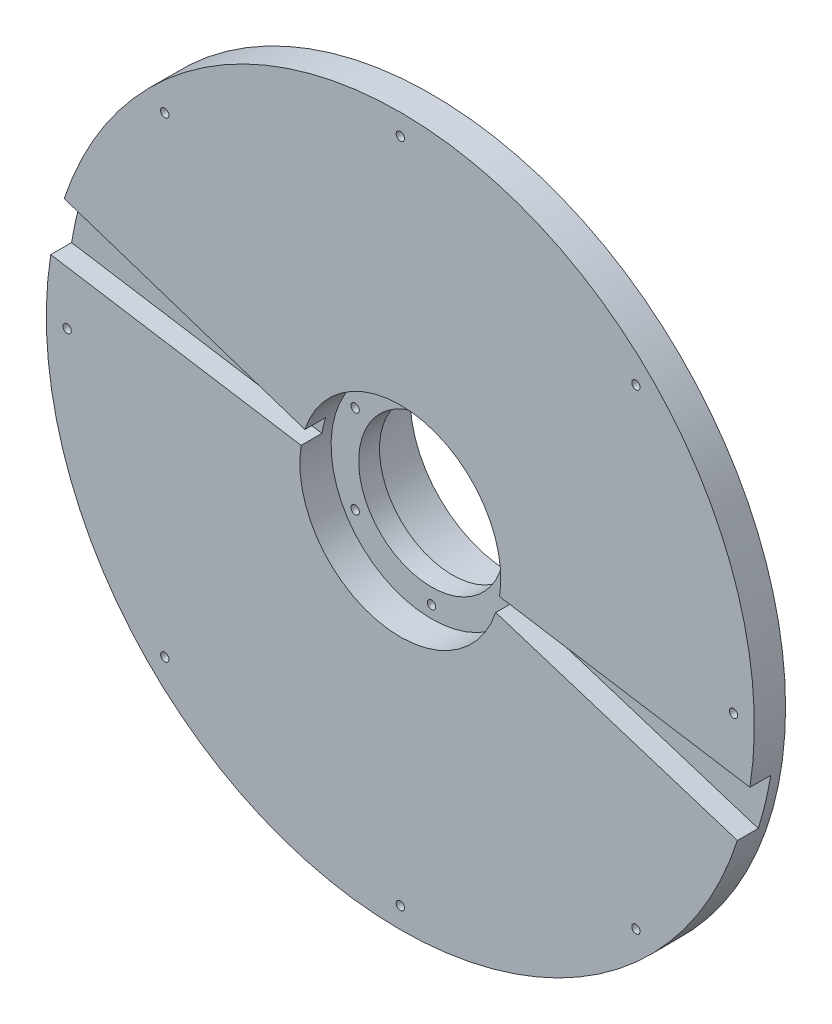
from build123d import *

# Parameters (mm, degrees)
SKETCH_1_R               = 60
EXTRUDE_1_DEPTH          = 28
SKETCH_2_R               = 48.25
CUT_EXTRUDE_1_DEPTH      = 90.353231615
SKETCH_4_R               = 150
EXTRUDE_3_DEPTH          = 10
SKETCH_5_R               = 35
CUT_EXTRUDE_2_DEPTH      = 216.50870052
SKETCH_6_R               = 2
CUT_EXTRUDE_3_DEPTH      = 216.50870052
PATTERN_CIRCULAR_1_COUNT = 6
EXTRUDE_START            = 15
SKETCH_7_R               = 170
SKETCH_7_R_2             = 48.25
EXTRUDE_4_DEPTH          = 15
SKETCH_9_R               = 2
CUT_EXTRUDE_4_DEPTH      = 244.40090386
PATTERN_CIRCULAR_2_COUNT = 8
CUT_EXTRUDE_5_DEPTH      = 10


with BuildPart() as part:
    # 草图1 → 凸台-拉伸1 (new body)
    with BuildSketch(Plane.XY):
        Circle(SKETCH_1_R)
    extrude(amount=EXTRUDE_1_DEPTH)

    # 草图2 → 切除-拉伸1 (cut, through all)
    with BuildSketch(Plane.XY.offset(28)):
        Circle(SKETCH_2_R)
    extrude(amount=-CUT_EXTRUDE_1_DEPTH, mode=Mode.SUBTRACT)

    # 草图4 → 凸台-拉伸3 (add)
    with BuildSketch(Plane.XY.offset(28)):
        Circle(SKETCH_4_R)
    extrude(amount=EXTRUDE_3_DEPTH)

    # 草图5 → 切除-拉伸2 (cut, through all)
    with BuildSketch(Plane.XY.offset(38)):
        Circle(SKETCH_5_R)
    extrude(amount=-CUT_EXTRUDE_2_DEPTH, mode=Mode.SUBTRACT)

    # 草图6 → 切除-拉伸3 (cut, through all)
    with BuildSketch(Plane.XY.offset(38)):
        with Locations((0, 42.356738024)):
            Circle(SKETCH_6_R)
    cut_extrude_3 = extrude(amount=-CUT_EXTRUDE_3_DEPTH, mode=Mode.SUBTRACT)

    # 阵列(圆周)1: 切除-拉伸3 ×6 about axis
    pattern_circular_1_axis = Axis((0, 0, 0), (0, 0, 1))
    for i in range(1, PATTERN_CIRCULAR_1_COUNT):
        add(cut_extrude_3.rotate(pattern_circular_1_axis, i * 360 / PATTERN_CIRCULAR_1_COUNT), mode=Mode.SUBTRACT)

    # 草图7 → 凸台-拉伸4 (add)
    with BuildSketch(Plane.XY.offset(38).offset(EXTRUDE_START)):
        Circle(SKETCH_7_R)
        Circle(SKETCH_7_R_2, mode=Mode.SUBTRACT)
    extrude(amount=-EXTRUDE_4_DEPTH)

    # 草图9 → 切除-拉伸4 (cut, through all)
    with BuildSketch(Plane(origin=(0, 0, 38), x_dir=(-1, 0, 0), z_dir=(0, 0, -1))):
        with Locations((0, 160)):
            Circle(SKETCH_9_R)
    cut_extrude_4 = extrude(amount=-CUT_EXTRUDE_4_DEPTH, mode=Mode.SUBTRACT)

    # 阵列(圆周)2: 切除-拉伸4 ×8 about axis
    pattern_circular_2_axis = Axis((0, 0, 0), (0, 0, 1))
    for i in range(1, PATTERN_CIRCULAR_2_COUNT):
        add(cut_extrude_4.rotate(pattern_circular_2_axis, i * 360 / PATTERN_CIRCULAR_2_COUNT), mode=Mode.SUBTRACT)

    # 草图11 → 切除-拉伸5 (cut)
    with BuildSketch(Plane.XY.offset(53)):
        with BuildLine():
            Line((47.645322741, -7.614835578), (167.869530902, -26.829472503))
            ThreePointArc((167.869530902, -26.829472503), (165.346802936, -39.502338652), (161.868807028, -51.946985586))
            Line((161.868807028, -51.946985586), (45.810704842, -15.147337122))
            ThreePointArc((45.810704842, -15.147337122), (46.879546902, -11.417993791), (47.645322741, -7.614835578))
        make_face()
        with BuildLine():
            Line((-45.810704842, 15.147337122), (-161.405592189, 53.368856183))
            ThreePointArc((-161.405592189, 53.368856183), (-165.171460589, 40.229200923), (-167.869530902, 26.829472503))
            Line((-167.869530902, 26.829472503), (-47.645322741, 7.614835578))
            ThreePointArc((-47.645322741, 7.614835578), (-46.879546902, 11.417993791), (-45.810704842, 15.147337122))
        make_face()
    extrude(amount=-CUT_EXTRUDE_5_DEPTH, mode=Mode.SUBTRACT)


solid = part.part
